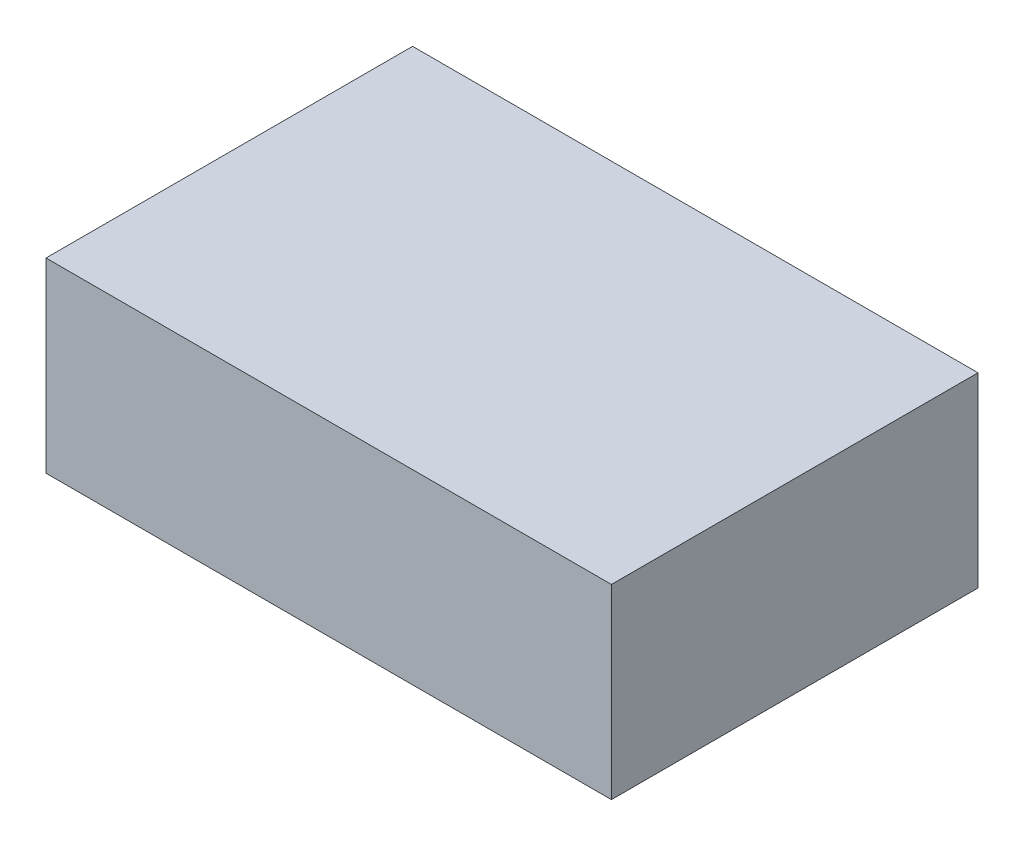
from build123d import *

# Parameters (mm, degrees)
SKETCH1_W           = 91
SKETCH1_H           = 59
BOSS_EXTRUDE1_DEPTH = 30


with BuildPart() as part:
    # Sketch1 → Boss-Extrude1 (new body)
    with BuildSketch(Plane(origin=(0, 0, 0), x_dir=(1, 0, 0), z_dir=(0, 1, 0))):
        with Locations((45.5, 29.5)):
            Rectangle(SKETCH1_W, SKETCH1_H)
    extrude(amount=BOSS_EXTRUDE1_DEPTH)


solid = part.part
